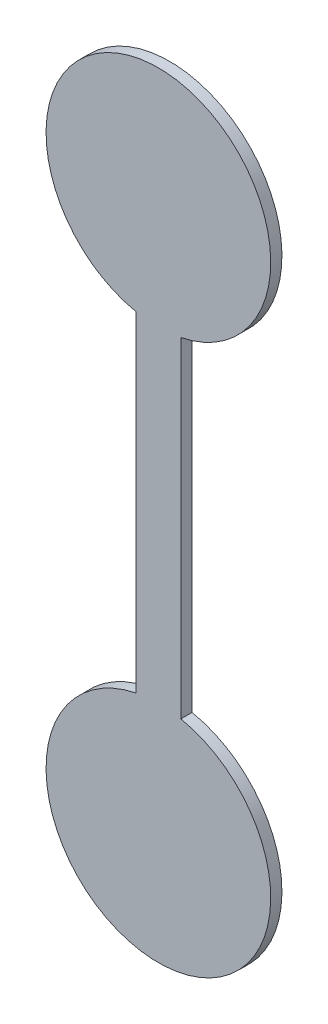
from build123d import *

# Parameters (mm, degrees)
SKETCH1_R           = 100
BOSS_EXTRUDE1_DEPTH = 5


with BuildPart() as part:
    # Sketch1 → Boss-Extrude1 (new, symmetric)
    with BuildSketch(Plane.XY):
        Circle(SKETCH1_R)
        with Locations((0, 490)):
            Circle(SKETCH1_R)
        with BuildLine():
            Line((-20, 0), (-20, 490))
            ThreePointArc((-20, 490), (0, 510), (20, 490))
            Line((20, 490), (20, 0))
            ThreePointArc((20, 0), (0, -20), (-20, 0))
        make_face()
    extrude(amount=BOSS_EXTRUDE1_DEPTH, both=True)


solid = part.part
